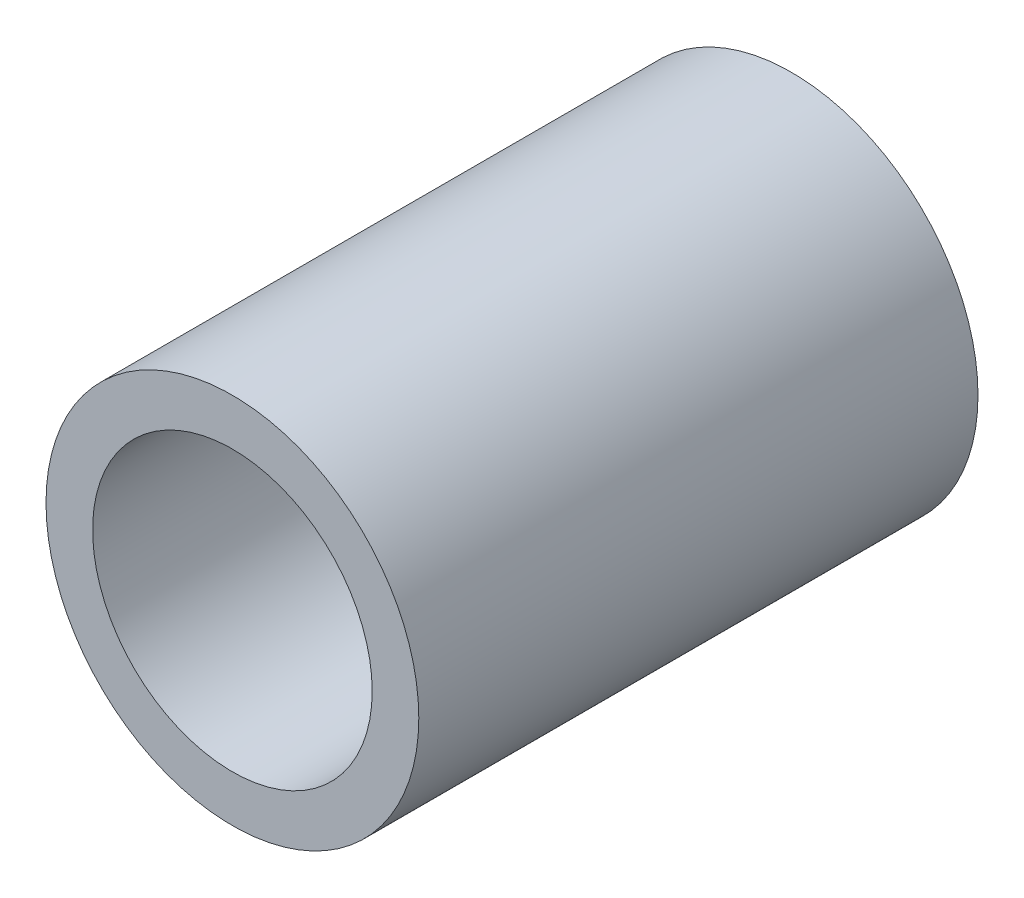
from build123d import *

# Parameters (mm, degrees)
IZIM1_R                     = 40
IZIM1_R_2                   = 30
Y_KSEKLIK_EKSTR_ZYON1_DEPTH = 120


with BuildPart() as part:
    # Çizim1 → Yükseklik-Ekstrüzyon1 (new body)
    with BuildSketch(Plane.XY):
        Circle(IZIM1_R)
        Circle(IZIM1_R_2, mode=Mode.SUBTRACT)
    extrude(amount=Y_KSEKLIK_EKSTR_ZYON1_DEPTH)


solid = part.part
